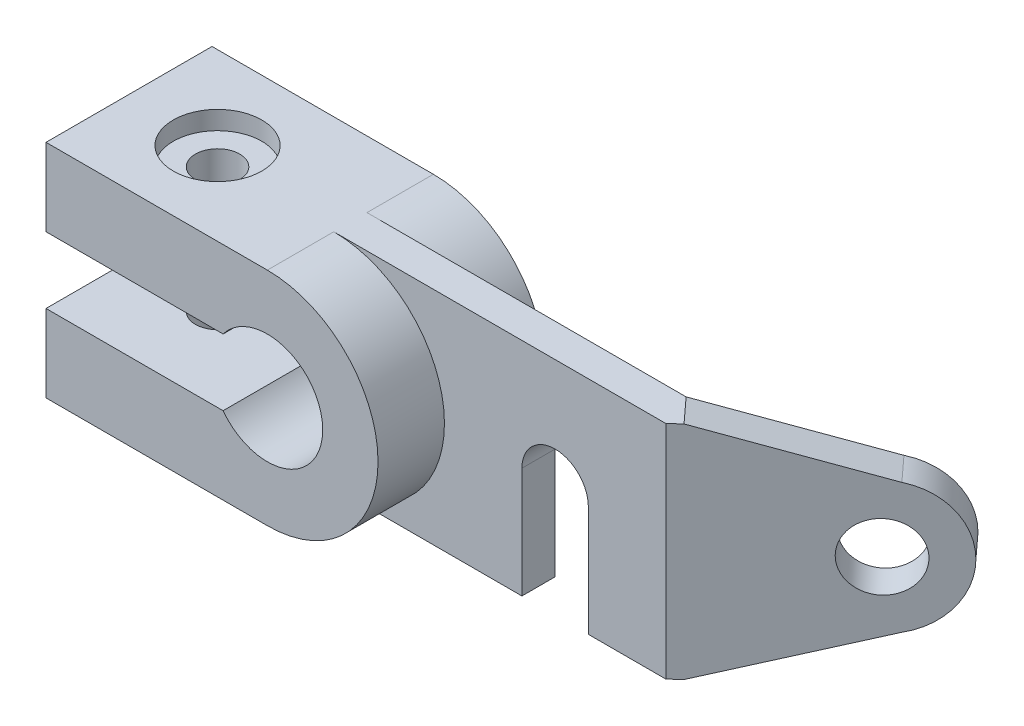
from build123d import *
from build123d.topology import SkipClean

# Parameters (mm, degrees)
BOSS_EXTRUDE1_DEPTH                      = 45
CBORE_FOR_M10_HEX_HEAD_BOLT1_D           = 12
CBORE_FOR_M10_HEX_HEAD_BOLT1_DEPTH       = 21
CBORE_FOR_M10_HEX_HEAD_BOLT1_CBORE_D     = 24
CBORE_FOR_M10_HEX_HEAD_BOLT1_CBORE_DEPTH = 5
CBORE_FOR_M10_HEX_HEAD_BOLT1_TIP         = 3.605163714
CBORE_FOR_M10_HEX_HEAD_BOLT2_D           = 12
CBORE_FOR_M10_HEX_HEAD_BOLT2_CBORE_D     = 24
CBORE_FOR_M10_HEX_HEAD_BOLT2_CBORE_DEPTH = 5
SKETCH8_W                                = 9
SKETCH8_H                                = 60
BOSS_EXTRUDE5_DEPTH                      = 150
SKETCH11_R                               = 12
CUT_EXTRUDE3_DEPTH                       = 5
SKETCH13_R                               = 6
CUT_EXTRUDE4_DEPTH                       = 99
SKETCH14_R                               = 12
CUT_EXTRUDE5_DEPTH                       = 5
CUT_EXTRUDE6_START                       = -68
CUT_EXTRUDE6_DEPTH                       = 68
BOSS_EXTRUDE8_DEPTH                      = 60
CUT_EXTRUDE7_DEPTH                       = 68
SKETCH18_R                               = 9
CUT_EXTRUDE8_DEPTH                       = 68
CUT_EXTRUDE9_DEPTH                       = 68


with BuildPart() as part:
    # Sketch1 → Boss-Extrude1 (new body)
    with BuildSketch(Plane.XY):
        with BuildLine():
            Line((0, 30), (-60, 30))
            Line((-60, 30), (-60, 9))
            Line((-60, 9), (-12, 9))
            ThreePointArc((-12, 9), (15, 0), (-12, -9))
            Line((-12, -9), (-60, -9))
            Line((-60, -9), (-60, -30))
            Line((-60, -30), (0, -30))
            ThreePointArc((0, -30), (30, 0), (0, 30))
        make_face()
    extrude(amount=BOSS_EXTRUDE1_DEPTH)

    # CBORE for M10 Hex Head Bolt1
    with Locations(Plane(origin=(0, 30, 0), x_dir=(1, 0, 0), z_dir=(0, 1, 0))):
        with Locations((-36, -22.5)):
            CounterBoreHole(CBORE_FOR_M10_HEX_HEAD_BOLT1_D / 2, CBORE_FOR_M10_HEX_HEAD_BOLT1_CBORE_D / 2, CBORE_FOR_M10_HEX_HEAD_BOLT1_CBORE_DEPTH, depth=CBORE_FOR_M10_HEX_HEAD_BOLT1_DEPTH)
            with Locations((0, 0, -(CBORE_FOR_M10_HEX_HEAD_BOLT1_DEPTH + CBORE_FOR_M10_HEX_HEAD_BOLT1_TIP / 2))):  # 118° drill point
                Cone(0, CBORE_FOR_M10_HEX_HEAD_BOLT1_D / 2, CBORE_FOR_M10_HEX_HEAD_BOLT1_TIP, mode=Mode.SUBTRACT)

    # CBORE for M10 Hex Head Bolt2 (through all)
    with Locations(Plane(origin=(0, -30, 0), x_dir=(-1, 0, 0), z_dir=(0, -1, 0))):
        with Locations((36, -22.5)):
            CounterBoreHole(CBORE_FOR_M10_HEX_HEAD_BOLT2_D / 2, CBORE_FOR_M10_HEX_HEAD_BOLT2_CBORE_D / 2, CBORE_FOR_M10_HEX_HEAD_BOLT2_CBORE_DEPTH)

    # Sketch8 → Boss-Extrude5 (add)
    with BuildSketch(Plane.ZY.offset(60)):
        with Locations((22.5, 0)):
            Rectangle(SKETCH8_W, SKETCH8_H)
    extrude(amount=-BOSS_EXTRUDE5_DEPTH)

    # Sketch11 → Cut-Extrude3 (cut)
    with BuildSketch(Plane(origin=(0, 30, 0), x_dir=(1, 0, 0), z_dir=(0, 1, 0))):
        with Locations(Location((-36, -22.5, 0), (0, 0, 270))):
            Circle(SKETCH11_R)
    extrude(amount=-CUT_EXTRUDE3_DEPTH, mode=Mode.SUBTRACT)

    # Sketch13 → Cut-Extrude4 (cut)
    with SkipClean():  # the faces are left unmerged after this step: merging them gives an invalid solid
        with BuildSketch(Plane(origin=(0, 30, 0), x_dir=(1, 0, 0), z_dir=(0, 1, 0))):
            with Locations(Location((-36, -22.5, 0), (0, 0, 270))):
                Circle(SKETCH13_R)
        extrude(amount=-CUT_EXTRUDE4_DEPTH, mode=Mode.SUBTRACT)

    # Sketch14 → Cut-Extrude5 (cut)
    with SkipClean():  # the faces are left unmerged after this step: merging them gives an invalid solid
        with BuildSketch(Plane.XZ.offset(30)):
            with Locations(Location((-36, 22.5, 0), (0, 0, 90))):
                Circle(SKETCH14_R)
        extrude(amount=-CUT_EXTRUDE5_DEPTH, mode=Mode.SUBTRACT)

    # Sketch15 → Cut-Extrude6 (cut)
    with BuildSketch(Plane.XY.offset(27).offset(CUT_EXTRUDE6_START)):
        with BuildLine():
            Line((-12, 9), (-60, 9))
            Line((-60, 9), (-60, -9))
            Line((-60, -9), (-12, -9))
            ThreePointArc((-12, -9), (15, 0), (-12, 9))
        make_face()
    extrude(amount=CUT_EXTRUDE6_DEPTH, mode=Mode.SUBTRACT)

    # Sketch16 → Boss-Extrude8 (add)
    with BuildSketch(Plane(origin=(0, 30, 0), x_dir=(1, 0, 0), z_dir=(0, 1, 0))):
        Polygon((90, -27), (134.636969371, 13.838596515), (128.561806253, 20.478806835), (83.924836882, -20.35978968), align=None)
    extrude(amount=-BOSS_EXTRUDE8_DEPTH)

    # Sketch17 → Cut-Extrude7 (cut)
    with BuildSketch(Plane(origin=(48.380075948, 0, 52.879877188), x_dir=(-0.7378011466347597, 0, 0.6750181242192198), z_dir=(-0.6750181242192198, 0, -0.7378011466347597))):
        with BuildLine():
            Line((-51.672504688, -30), (-93.46941491, -17.594984307))
            ThreePointArc((-93.46941491, -17.594984307), (-107.672504688, 0), (-93.46941491, 17.594984307))
            Line((-93.46941491, 17.594984307), (-51.672504688, 30))
            Line((-51.672504688, 30), (-131.97504834, 46.212798572))
            Line((-131.97504834, 46.212798572), (-125.335440866, -48.202419702))
            Line((-125.335440866, -48.202419702), (-41.145218102, -48.202419702))
            Line((-41.145218102, -48.202419702), (-51.672504688, -30))
        make_face()
    extrude(amount=-CUT_EXTRUDE7_DEPTH, mode=Mode.SUBTRACT)

    # Sketch18 → Cut-Extrude8 (cut)
    with BuildSketch(Plane(origin=(48.380075948, 0, 52.879877188), x_dir=(-0.7378011466347597, 0, 0.6750181242192198), z_dir=(-0.6750181242192198, 0, -0.7378011466347597))):
        with Locations((-89.672504688, 0)):
            Circle(SKETCH18_R)
    extrude(amount=-CUT_EXTRUDE8_DEPTH, mode=Mode.SUBTRACT)

    # Sketch19 → Cut-Extrude9 (cut)
    with BuildSketch(Plane(origin=(0, 0, 18), x_dir=(-1, 0, 0), z_dir=(0, 0, -1))):
        with BuildLine():
            Line((-69, 0), (-69, -30))
            Line((-69, -30), (-51, -30))
            Line((-51, -30), (-51, 0))
            ThreePointArc((-51, 0), (-60, 9), (-69, 0))
        make_face()
    extrude(amount=-CUT_EXTRUDE9_DEPTH, mode=Mode.SUBTRACT)


solid = part.part
